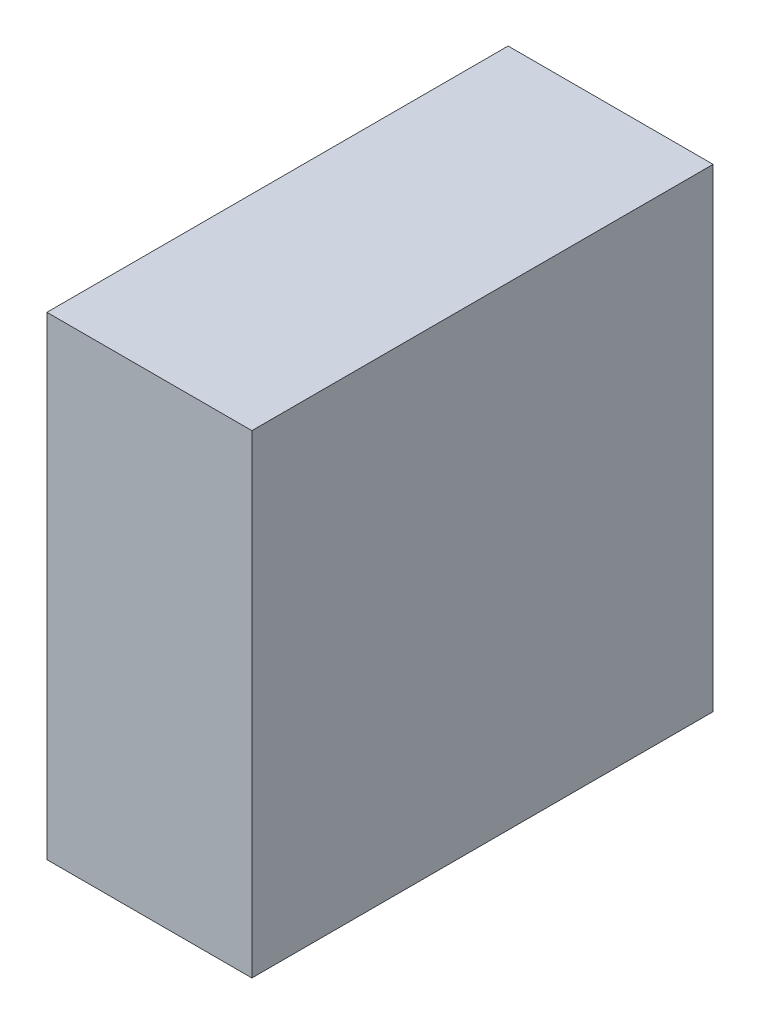
from build123d import *

# Parameters (mm, degrees)
SKETCH1_W           = 18.5
SKETCH1_H           = 18
BOSS_EXTRUDE1_DEPTH = 4


with BuildPart() as part:
    # Sketch1 → Boss-Extrude1 (new, symmetric)
    with BuildSketch(Plane.YZ):
        Rectangle(SKETCH1_W, SKETCH1_H)
    extrude(amount=BOSS_EXTRUDE1_DEPTH, both=True)


solid = part.part
